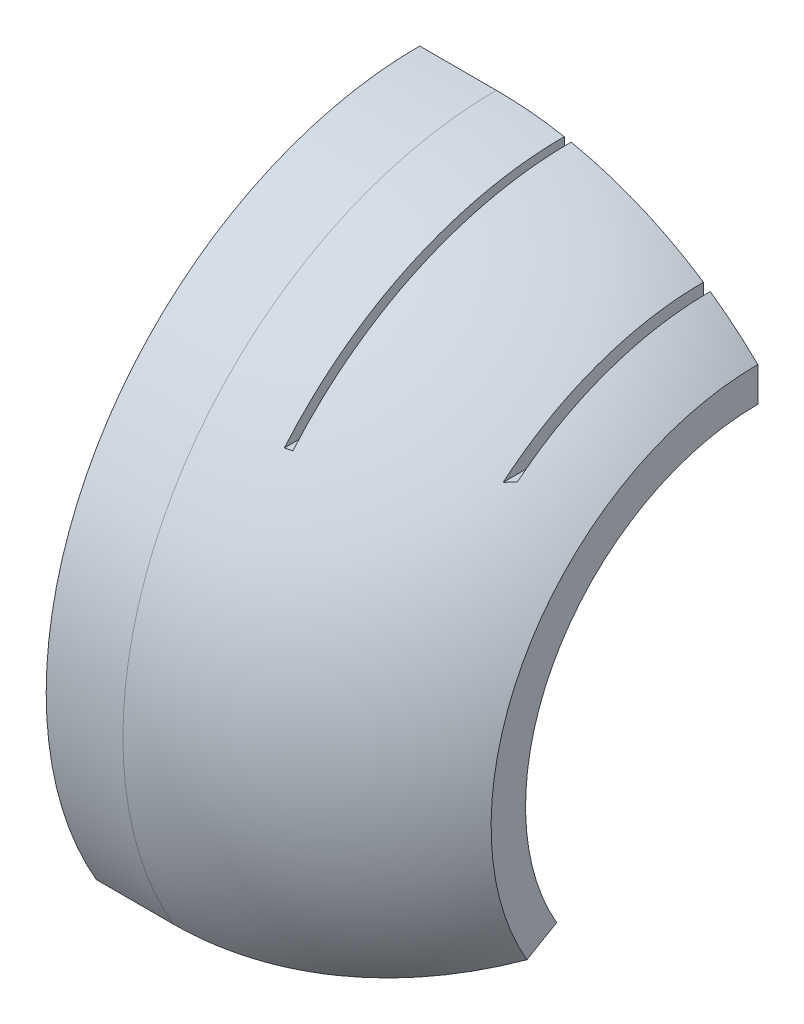
from build123d import *

# Parameters (mm, degrees)
CUT_EXTRUDE_1_DEPTH      = 96.262794416
CUT_EXTRUDE_1_DEPTH_BACK = 96.262794416
SKETCH_2_W               = 55
SKETCH_2_H               = 110
CUT_EXTRUDE_2_DEPTH      = 96.262794416
CUT_EXTRUDE_2_DEPTH_BACK = 96.262794416
SKETCH_3_W               = 23.273135213
SKETCH_3_H               = 110
CUT_EXTRUDE_3_DEPTH      = 87.788536109
SKETCH_5_W               = 1
SKETCH_5_H               = 20
CUT_EXTRUDE_4_DEPTH      = 87.788536109
SKETCH_6_W               = 11.3
SKETCH_6_H               = 3.5
CUT_EXTRUDE_START        = -10
CUT_EXTRUDE_5_DEPTH      = 10
CUT_EXTRUDE_7_DEPTH      = 99.910110707
CUT_EXTRUDE_8_DEPTH      = 70
CUT_EXTRUDE_8_DEPTH_BACK = 70
CUT_EXTRUDE_9_DEPTH      = 70


with BuildPart() as part:
    # 草图1 → 旋转8 (revolve)
    with BuildSketch(Plane.XY):
        with BuildLine():
            Line((0, 55), (0, 51.5))
            ThreePointArc((0, 51.5), (-51.5, 0), (0, -51.5))
            Line((0, -51.5), (0, -55))
            ThreePointArc((0, -55), (-55, 0), (0, 55))
        make_face()
    revolve(axis=Axis((0, 0, 0), (0, 1, 0)))

    # 草图2 → 切除-拉伸1 (cut, two sides: drawn at the far end of the back side and taken through both)
    with BuildSketch(Plane.XY.offset(-CUT_EXTRUDE_1_DEPTH_BACK)):
        with Locations((27.5, 0)):
            Rectangle(SKETCH_2_W, SKETCH_2_H)
    extrude(amount=CUT_EXTRUDE_1_DEPTH + CUT_EXTRUDE_1_DEPTH_BACK, mode=Mode.SUBTRACT)

    # 草图3 → 切除-拉伸2 (cut, two sides: drawn at the far end of the back side and taken through both)
    with BuildSketch(Plane.XY.offset(-CUT_EXTRUDE_2_DEPTH_BACK)):
        with Locations((-50.136567607, 0)):
            Rectangle(SKETCH_3_W, SKETCH_3_H)
    extrude(amount=CUT_EXTRUDE_2_DEPTH + CUT_EXTRUDE_2_DEPTH_BACK, mode=Mode.SUBTRACT)

    # 草图4 → 切除-拉伸3 (cut, through all)
    with BuildSketch(Plane.ZY.offset(38.5)):
        with BuildLine():
            Line((0, 0), (0, 64.529887393))
            ThreePointArc((0, 64.529887393), (-55.884521786, -32.264943697), (55.884521786, -32.264943697))
            Line((55.884521786, -32.264943697), (0, 0))
        make_face()
    extrude(amount=-CUT_EXTRUDE_3_DEPTH, mode=Mode.SUBTRACT)

    # 草图5 → 切除-拉伸4 (cut, through all)
    with BuildSketch(Plane(origin=(0, 0, 0), x_dir=(-1, 0, 0), z_dir=(0, 0, -1))):
        with Locations((31, 45)):
            Rectangle(SKETCH_5_W, SKETCH_5_H)
        with Locations((10.5, 45)):
            Rectangle(SKETCH_5_W, SKETCH_5_H)
    extrude(amount=-CUT_EXTRUDE_4_DEPTH, mode=Mode.SUBTRACT)

    # 草图6 → 旋转9 (revolve)
    with BuildSketch(Plane.XY):
        with Locations((5.65, 53.25)):
            Rectangle(SKETCH_6_W, SKETCH_6_H)
    revolve(axis=Axis((0, 0, 0), (1, 0, 0)))

    # 草图7 → 切除-拉伸5 (cut)
    with BuildSketch(Plane.ZY.offset(CUT_EXTRUDE_START)):
        with BuildLine():
            Line((0, 55), (0, 0))
            Line((0, 0), (47.631397208, -27.5))
            ThreePointArc((47.631397208, -27.5), (-47.631397208, -27.5), (0, 55))
        make_face()
    extrude(amount=CUT_EXTRUDE_5_DEPTH, mode=Mode.SUBTRACT)

    # 镜向1: part across plane


with BuildPart() as part_1:
    add(part.part)
    add(part.part.mirror(Plane(origin=(11.3, 55, 0), x_dir=(0, 0, 1), z_dir=(-1, 0, 0))))

    # 草图8 → 切除-拉伸7 (cut, through all)
    with BuildSketch(Plane.XY):
        Polygon((-38.5, 54.805759265), (-38.5, -31.439264279), (11.3, -31.439264279), (11.3, 56.704937245), align=None)
    extrude(amount=CUT_EXTRUDE_7_DEPTH, mode=Mode.SUBTRACT)

    # 草图9 → 切除-拉伸8 (cut, two sides: drawn at the far end of the back side and taken through both)
    with BuildSketch(Plane.XY.offset(-CUT_EXTRUDE_8_DEPTH_BACK)):
        Polygon((11.3, 55), (11.3, 58.911756152), (4.567331784, 58.911756152), (4.567331784, -60.848172915), (11.3, -60.848172915), align=None)
    extrude(amount=CUT_EXTRUDE_8_DEPTH + CUT_EXTRUDE_8_DEPTH_BACK, mode=Mode.SUBTRACT)

    # 草图10 → 切除-拉伸9 (cut)
    with BuildSketch(Plane(origin=(12.6, 0, 0), x_dir=(0, 0, -1), z_dir=(1, 0, 0))):
        with BuildLine():
            Line((0, 55), (0, 0))
            Line((0, 0), (-47.631397208, -27.5))
            ThreePointArc((-47.631397208, -27.5), (47.631397208, -27.5), (0, 55))
        make_face()
    extrude(amount=-CUT_EXTRUDE_9_DEPTH, mode=Mode.SUBTRACT)


solid = part_1.part
